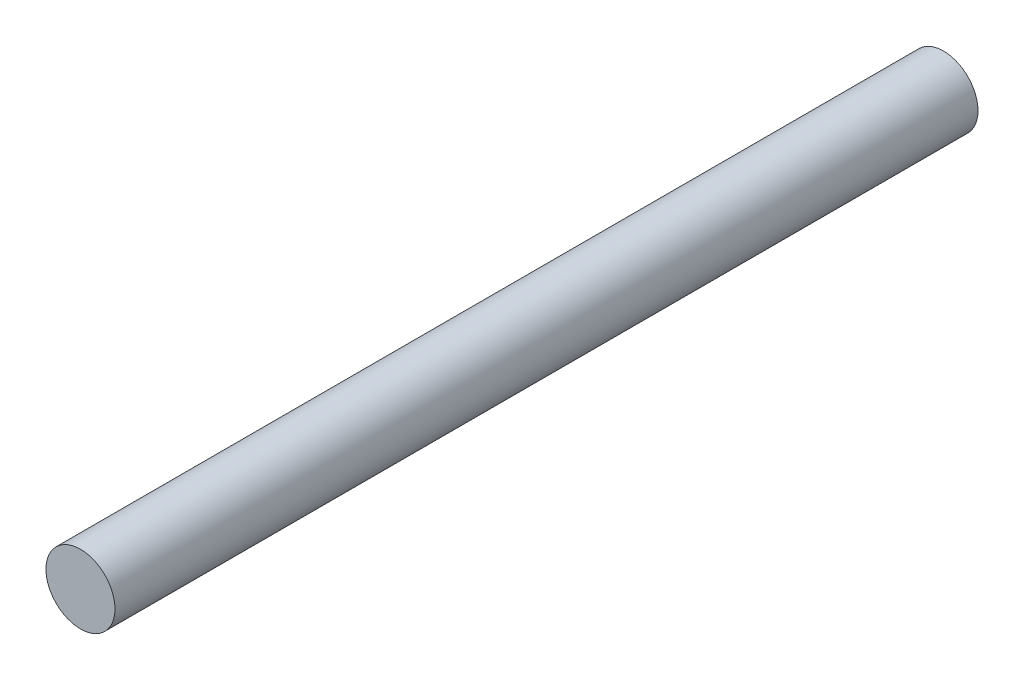
from build123d import *

# Parameters (mm, degrees)
SKETCH1_R           = 4
BOSS_EXTRUDE1_DEPTH = 50


with BuildPart() as part:
    # Sketch1 → Boss-Extrude1 (new, symmetric)
    with BuildSketch(Plane.XY):
        Circle(SKETCH1_R)
    extrude(amount=BOSS_EXTRUDE1_DEPTH, both=True)


solid = part.part
